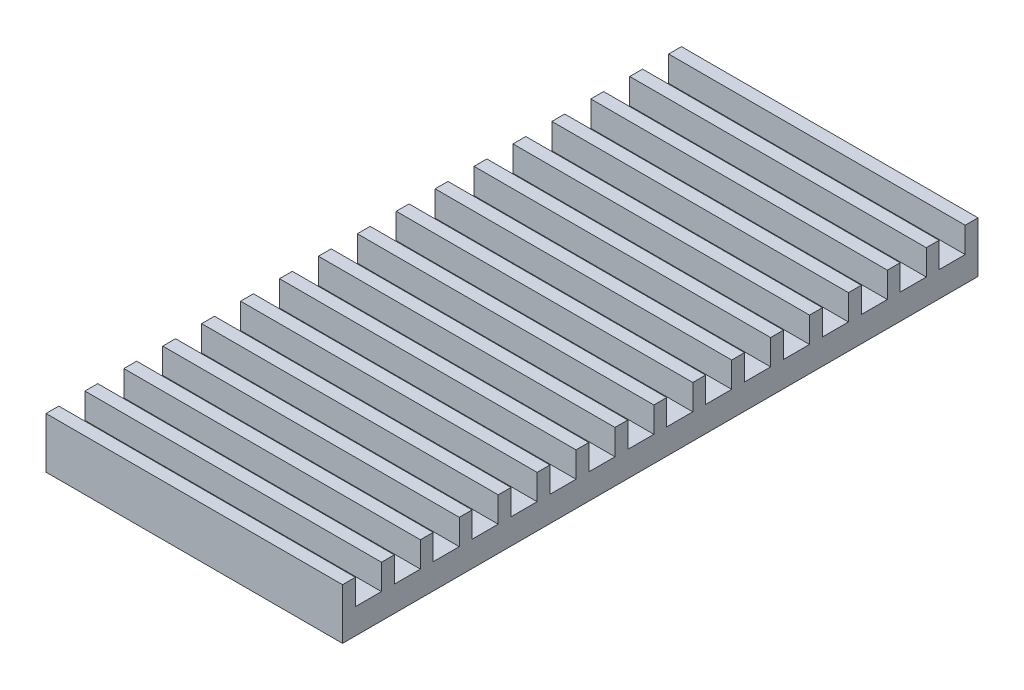
from build123d import *

# Parameters (mm, degrees)
SKETCH1_W           = 70
SKETCH1_H           = 150
BOSS_EXTRUDE1_DEPTH = 6
SKETCH2_W           = 70
SKETCH2_H           = 3.0237272
BOSS_EXTRUDE2_DEPTH = 6


with BuildPart() as part:
    # Sketch1 → Boss-Extrude1 (new body)
    with BuildSketch(Plane(origin=(0, 0, 0), x_dir=(1, 0, 0), z_dir=(0, 1, 0))):
        with Locations((35, 75)):
            Rectangle(SKETCH1_W, SKETCH1_H)
    extrude(amount=BOSS_EXTRUDE1_DEPTH)

    # Sketch2 → Boss-Extrude2 (add)
    with BuildSketch(Plane(origin=(0, 6, 0), x_dir=(1, 0, 0), z_dir=(0, 1, 0))):
        with Locations((35, 1.5118636)):
            Rectangle(SKETCH2_W, SKETCH2_H)
        with Locations((35, 10.69788065)):
            Rectangle(SKETCH2_W, SKETCH2_H)
        with Locations((35, 19.8838977)):
            Rectangle(SKETCH2_W, SKETCH2_H)
        with Locations((35, 29.06991475)):
            Rectangle(SKETCH2_W, SKETCH2_H)
        with Locations((35, 38.2559318)):
            Rectangle(SKETCH2_W, SKETCH2_H)
        with Locations((35, 47.44194885)):
            Rectangle(SKETCH2_W, SKETCH2_H)
        with Locations((35, 56.6279659)):
            Rectangle(SKETCH2_W, SKETCH2_H)
        with Locations((35, 65.81398295)):
            Rectangle(SKETCH2_W, SKETCH2_H)
        with Locations((35, 75)):
            Rectangle(SKETCH2_W, SKETCH2_H)
        with Locations((35, 84.18601705)):
            Rectangle(SKETCH2_W, SKETCH2_H)
        with Locations((35, 93.3720341)):
            Rectangle(SKETCH2_W, SKETCH2_H)
        with Locations((35, 102.55805115)):
            Rectangle(SKETCH2_W, SKETCH2_H)
        with Locations((35, 111.7440682)):
            Rectangle(SKETCH2_W, SKETCH2_H)
        with Locations((35, 120.93008525)):
            Rectangle(SKETCH2_W, SKETCH2_H)
        with Locations((35, 130.1161023)):
            Rectangle(SKETCH2_W, SKETCH2_H)
        with Locations((35, 139.30211935)):
            Rectangle(SKETCH2_W, SKETCH2_H)
        with Locations((35, 148.4881364)):
            Rectangle(SKETCH2_W, SKETCH2_H)
    extrude(amount=BOSS_EXTRUDE2_DEPTH)


solid = part.part
